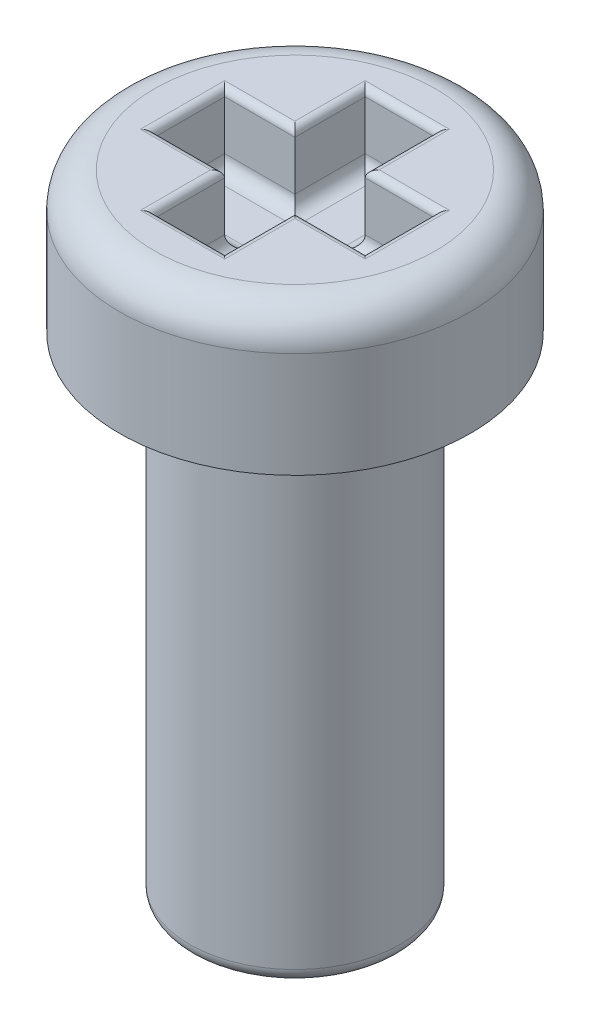
from build123d import *

# Parameters (mm, degrees)
SKETCH1_R           = 1.5
BOSS_EXTRUDE1_DEPTH = 7
FILLET1_R           = 0.2
SKETCH2_W           = 2.5
SKETCH2_H           = 2
CUT_EXTRUDE1_DEPTH  = 1
FILLET3_R           = 0.1
FILLET4_R           = 0.2
FILLET5_R           = 0.5


with BuildPart() as part:
    # Sketch1 → Boss-Extrude1 (new body)
    with BuildSketch(Plane(origin=(0, 0, 0), x_dir=(1, 0, 0), z_dir=(0, 1, 0))):
        with Locations(Location((0, 0, 0), (0, 0, 270))):
            Circle(SKETCH1_R)
    extrude(amount=BOSS_EXTRUDE1_DEPTH)

    # Fillet1
    fillet1_edges = [part.edges().sort_by_distance(p)[0] for p in [
        (0, 0, -1.5),
    ]]
    fillet(fillet1_edges, radius=FILLET1_R)

    # Sketch2 → Revolve1 (revolve)
    with BuildSketch(Plane.XY, mode=Mode.PRIVATE) as revolve1_sk:
        with Locations((-1.25, 8)):
            Rectangle(SKETCH2_W, SKETCH2_H)
    revolve(revolve1_sk.sketch.rotate(Axis((0, 0, 0), (0, 1, 0)), 270), axis=Axis((0, 0, 0), (0, 1, 0)))

    # Sketch3 → Cut-Extrude1 (cut)
    with BuildSketch(Plane(origin=(0, 9, 0), x_dir=(1, 0, 0), z_dir=(0, 1, 0))):
        Polygon((-0.5, 0.5), (-1.5, 0.5), (-1.5, -0.5), (-0.5, -0.5), (-0.5, -1.5), (0.5, -1.5), (0.5, -0.5), (1.5, -0.5), (1.5, 0.5), (0.5, 0.5), (0.5, 1.5), (-0.5, 1.5), align=None)
    extrude(amount=-CUT_EXTRUDE1_DEPTH, mode=Mode.SUBTRACT)

    # Fillet3
    fillet3_edges = [part.edges().sort_by_distance(p)[0] for p in [
        (0.5, 9, 1),
        (1, 9, 0.5),
        (1.5, 9, 0),
        (1, 9, -0.5),
        (0.5, 9, -1),
        (0, 9, -1.5),
        (-0.5, 9, -1),
        (-1, 9, -0.5),
        (-1.5, 9, 0),
        (-1, 9, 0.5),
        (-0.5, 9, 1),
        (0, 9, 1.5),
    ]]
    fillet(fillet3_edges, radius=FILLET3_R)

    # Fillet4
    fillet4_edges = [part.edges().sort_by_distance(p)[0] for p in [
        (0.5, 8, 1),
        (0, 8, 1.5),
        (-0.5, 8, 1),
        (-1, 8, 0.5),
        (-1.5, 8, 0),
        (-1, 8, -0.5),
        (-0.5, 8, -1),
        (0, 8, -1.5),
        (0.5, 8, -1),
        (1, 8, -0.5),
        (1.5, 8, 0),
        (1, 8, 0.5),
    ]]
    fillet(fillet4_edges, radius=FILLET4_R)

    # Fillet5
    fillet5_edges = [part.edges().sort_by_distance(p)[0] for p in [
        (0, 9, 2.5),
    ]]
    fillet(fillet5_edges, radius=FILLET5_R)


solid = part.part
